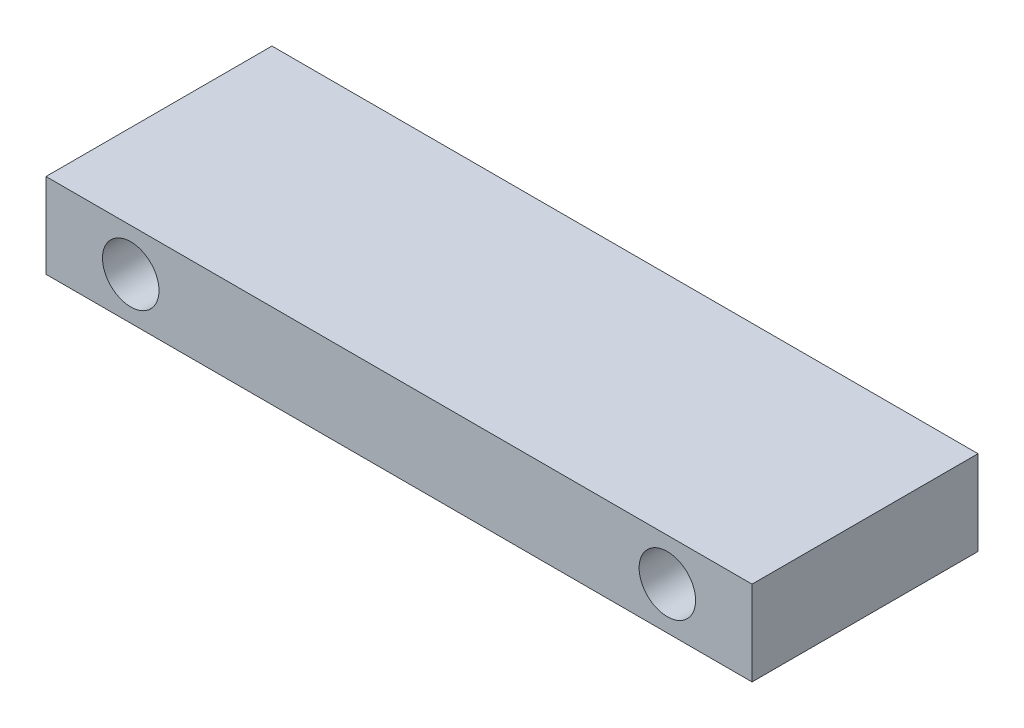
from build123d import *

# Parameters (mm, degrees)
SKETCH1_W           = 25
SKETCH1_H           = 3
SKETCH1_R           = 1
BOSS_EXTRUDE1_DEPTH = 8


with BuildPart() as part:
    # Sketch1 → Boss-Extrude1 (new body)
    with BuildSketch(Plane.XY):
        with Locations((-80.672815681, 33.809539276)):
            Rectangle(SKETCH1_W, SKETCH1_H)
        with Locations((-90.172815681, 33.809539276)):
            Circle(SKETCH1_R, mode=Mode.SUBTRACT)
        with Locations((-71.172815681, 33.809539276)):
            Circle(SKETCH1_R, mode=Mode.SUBTRACT)
    extrude(amount=BOSS_EXTRUDE1_DEPTH)


solid = part.part
